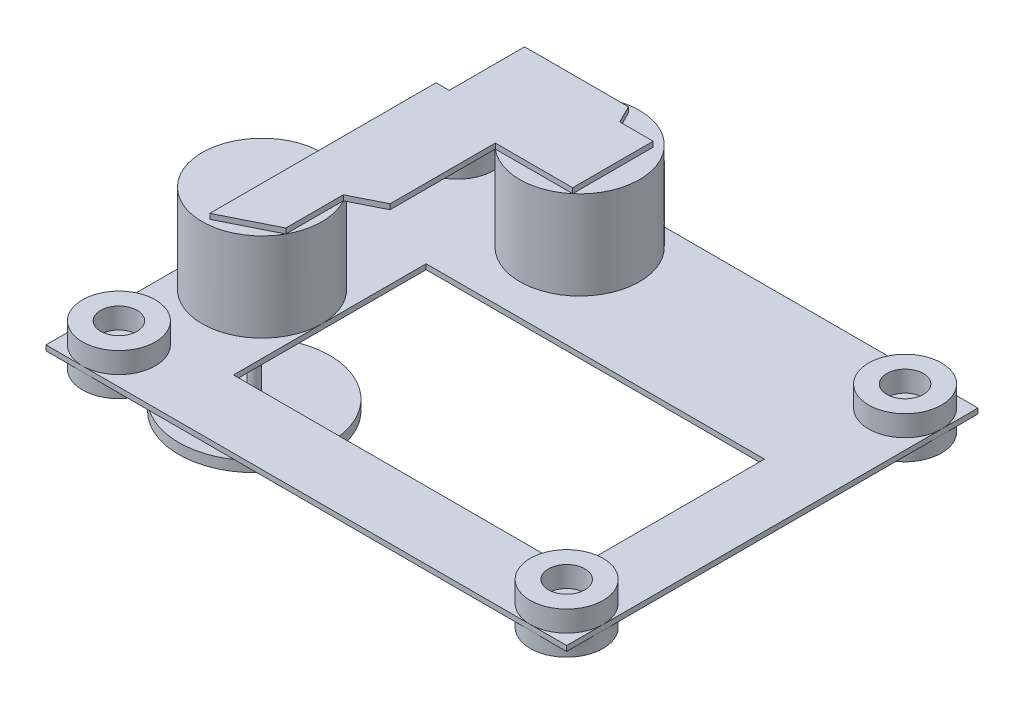
from build123d import *

# Parameters (mm, degrees)
ESQUISSE4_W             = 100
ESQUISSE4_H             = 79
BOSS_EXTRU_3_DEPTH      = 1
BOSS_EXTRU_4_DEPTH      = 4
BOSS_EXTRU_4_DEPTH_BACK = 4
ESQUISSE1_R             = 7
ESQUISSE1_R_2           = 3.5
ESQUISSE6_R             = 11.5
BOSS_EXTRU_5_DEPTH      = 17
BOSS_EXTRU_6_DEPTH      = 1
ESQUISSE8_W             = 65
ESQUISSE8_H             = 37
ENL_V_MAT_EXTRU_1_DEPTH = 1
ESQUISSE9_R             = 1
BOSS_EXTRU_7_DEPTH      = 18
ESQUISSE10_R            = 14.5
BOSS_EXTRU_8_DEPTH      = 2
ESQUISSE11_R            = 7.5
BOSS_EXTRU_9_DEPTH      = 4
CONG_1_R                = 3


with BuildPart() as part:
    # Esquisse4 → Boss.-Extru.3 (new body)
    with BuildSketch(Plane(origin=(0, 0, 0), x_dir=(1, 0, 0), z_dir=(0, 1, 0))):
        Rectangle(ESQUISSE4_W, ESQUISSE4_H)
    extrude(amount=-BOSS_EXTRU_3_DEPTH)

    # Esquisse1 → Boss.-Extru.4 (add, two sides: drawn at the far end of the back side and taken through both)
    # profile 1 of 4: a face of its own
    with BuildSketch(Plane(origin=(0, 0, 0), x_dir=(1, 0, 0), z_dir=(0, 1, 0)).offset(-BOSS_EXTRU_4_DEPTH_BACK)):
        with Locations((-43, -32.5)):
            Circle(ESQUISSE1_R)
        with Locations((-43, -32.5)):
            Circle(ESQUISSE1_R_2, mode=Mode.SUBTRACT)
    # profile 2 of 4: a face of its own
    with BuildSketch(Plane(origin=(0, 0, 0), x_dir=(1, 0, 0), z_dir=(0, 1, 0)).offset(-BOSS_EXTRU_4_DEPTH_BACK)):
        with Locations((43, -32.5)):
            Circle(ESQUISSE1_R)
        with Locations((43, -32.5)):
            Circle(ESQUISSE1_R_2, mode=Mode.SUBTRACT)
    # profile 3 of 4: a face of its own
    with BuildSketch(Plane(origin=(0, 0, 0), x_dir=(1, 0, 0), z_dir=(0, 1, 0)).offset(-BOSS_EXTRU_4_DEPTH_BACK)):
        with Locations((-43, 32.5)):
            Circle(ESQUISSE1_R)
        with Locations((-43, 32.5)):
            Circle(ESQUISSE1_R_2, mode=Mode.SUBTRACT)
    # profile 4 of 4: a face of its own
    with BuildSketch(Plane(origin=(0, 0, 0), x_dir=(1, 0, 0), z_dir=(0, 1, 0)).offset(-BOSS_EXTRU_4_DEPTH_BACK)):
        with Locations((43, 32.5)):
            Circle(ESQUISSE1_R)
        with Locations((43, 32.5)):
            Circle(ESQUISSE1_R_2, mode=Mode.SUBTRACT)
    extrude(amount=BOSS_EXTRU_4_DEPTH + BOSS_EXTRU_4_DEPTH_BACK)

    # Esquisse6 → Boss.-Extru.5 (add)
    with BuildSketch(Plane(origin=(0, 0, 0), x_dir=(1, 0, 0), z_dir=(0, 1, 0))):
        with Locations((-38.5, -9.5)):
            Circle(ESQUISSE6_R)
        with Locations((-15, 28)):
            Circle(ESQUISSE6_R)
    extrude(amount=BOSS_EXTRU_5_DEPTH)

    # Esquisse7 → Boss.-Extru.6 (add)
    with BuildSketch(Plane(origin=(0, 17, 0), x_dir=(1, 0, 0), z_dir=(0, 1, 0))):
        Polygon((-38.143774149, -19.88751618), (-28.414215556, -15.025120102), (-28.414215556, -3.974879898), (-22.428299765, -0.98338823), (-22.428299765, 19.221027247), (-7.571700235, 19.221027247), (-7.571700235, 34.680148422), (-13.988712335, 34.680148422), (-15.667356388, 38.039082045), (-35.613243864, 38.039082045), (-35.613243864, 23.559466539), (-38.143774149, 23.559466539), (-38.143774149, 0), align=None)
    extrude(amount=BOSS_EXTRU_6_DEPTH)

    # Esquisse8 → Enlèv. mat.-Extru.1 (cut)
    with BuildSketch(Plane(origin=(0, 0, 0), x_dir=(1, 0, 0), z_dir=(0, 1, 0))):
        with Locations((5.5, -8)):
            Rectangle(ESQUISSE8_W, ESQUISSE8_H)
    extrude(amount=-ENL_V_MAT_EXTRU_1_DEPTH, mode=Mode.SUBTRACT)

    # Esquisse9 → Boss.-Extru.7 (add)
    with BuildSketch(Plane.XZ.offset(1)):
        with Locations((-40, 9.5)):
            Circle(ESQUISSE9_R)
    extrude(amount=BOSS_EXTRU_7_DEPTH)

    # Esquisse10 → Boss.-Extru.8 (add)
    with BuildSketch(Plane.XZ.offset(19)):
        with Locations((-40, 9.5)):
            Circle(ESQUISSE10_R)
    extrude(amount=BOSS_EXTRU_8_DEPTH)

    # Esquisse11 → Boss.-Extru.9 (add)
    with BuildSketch(Plane(origin=(0, -21, 0), x_dir=(-1, 0, 0), z_dir=(0, -1, 0))):
        with Locations((40, -9.5)):
            Circle(ESQUISSE11_R)
    extrude(amount=BOSS_EXTRU_9_DEPTH)

    # Congé1
    cong_1_edges = [part.edges().sort_by_distance(p)[0] for p in [
        (-32.5, -25, 9.5),
    ]]
    fillet(cong_1_edges, radius=CONG_1_R)


solid = part.part
